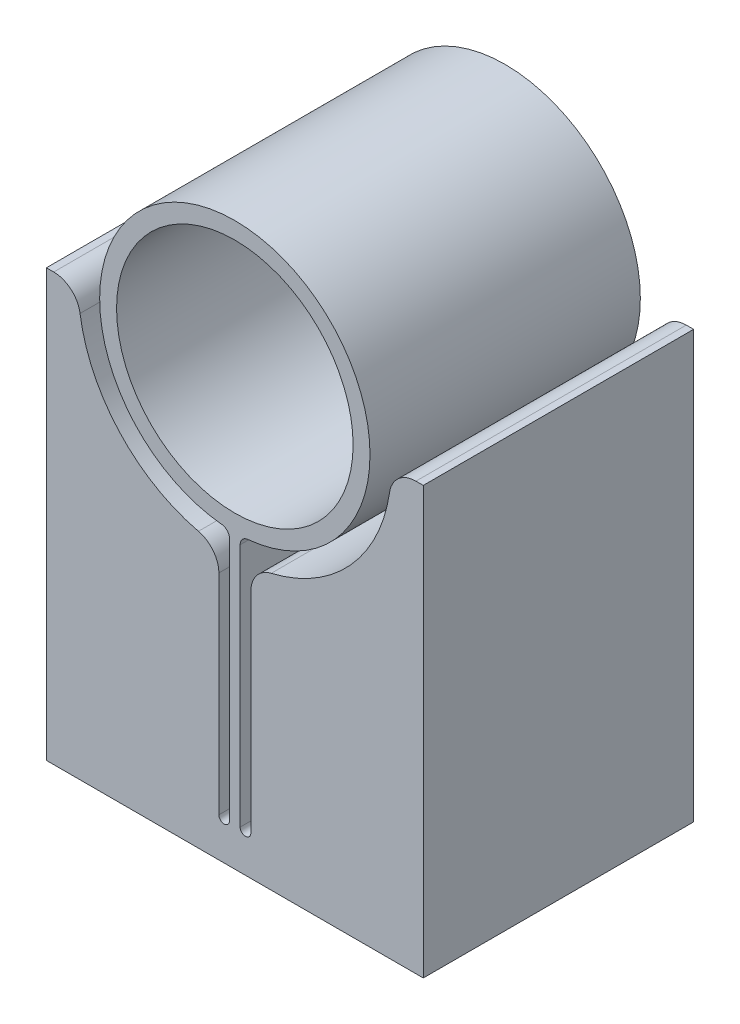
from build123d import *

# Parameters (mm, degrees)
SKETCH1_R                  = 11.1125
EXTRUDE1_DEPTH             = 12.7
BUSHING_SIDE_FILLETS_R     = 0.79375
MOUNT_SIDE_FILLETS_R       = 0.79375
F_1_4_MOUNTING_HOLES_D     = 5.1054
F_1_4_MOUNTING_HOLES_DEPTH = 19.05
F_1_4_MOUNTING_HOLES_TIP   = 1.533816902
CUT_EXTRUDE1_DEPTH         = 51.649420448
FILLET1_R                  = 2.5


with BuildPart() as part:
    # Sketch1 → Extrude1 (new, symmetric)
    with BuildSketch(Plane(origin=(0, 0, 0), x_dir=(1, 0, 0), z_dir=(0, 0, -1))):
        with BuildLine():
            Line((0.5, 12.690153663), (0.5, 30.5587))
            Line((0.5, 30.5587), (1.5, 30.5587))
            Line((1.5, 30.5587), (1.5, 14.623269128))
            ThreePointArc((1.5, 14.623269128), (10.911920088, 9.849873096), (14.7, 0))
            Line((14.7, 0), (17.705953405, 0))
            Line((17.705953405, 0), (17.705953405, 40.0837))
            Line((17.705953405, 40.0837), (-17.705953405, 40.0837))
            Line((-17.705953405, 40.0837), (-17.705953405, 0))
            Line((-17.705953405, 0), (-14.7, 0))
            ThreePointArc((-14.7, 0), (-10.911920088, 9.849873096), (-1.5, 14.623269128))
            Line((-1.5, 14.623269128), (-1.5, 30.5587))
            Line((-1.5, 30.5587), (-0.5, 30.5587))
            Line((-0.5, 30.5587), (-0.5, 12.690153663))
            ThreePointArc((-0.5, 12.690153663), (0, -12.7), (0.5, 12.690153663))
        make_face()
        Circle(SKETCH1_R, mode=Mode.SUBTRACT)
    extrude(amount=EXTRUDE1_DEPTH, both=True)

    # Bushing-side fillets
    bushing_side_fillets_edges = [part.edges().sort_by_distance(p)[0] for p in [
        (-0.5, -12.690153663, 0),
        (0.5, -12.690153663, 0),
    ]]
    fillet(bushing_side_fillets_edges, radius=BUSHING_SIDE_FILLETS_R)

    # Mount-side fillets
    mount_side_fillets_edges = [part.edges().sort_by_distance(p)[0] for p in [
        (-0.5, -30.5587, 0),
        (0.5, -30.5587, 0),
    ]]
    fillet(mount_side_fillets_edges, radius=MOUNT_SIDE_FILLETS_R)

    # 1/4 Mounting holes
    with Locations(Plane.XZ.offset(40.0837)):
        with Locations((-12.7, 0), (12.7, 0)):
            Hole(F_1_4_MOUNTING_HOLES_D / 2, depth=F_1_4_MOUNTING_HOLES_DEPTH)
            with Locations((0, 0, -(F_1_4_MOUNTING_HOLES_DEPTH + F_1_4_MOUNTING_HOLES_TIP / 2))):  # 118° drill point
                Cone(0, F_1_4_MOUNTING_HOLES_D / 2, F_1_4_MOUNTING_HOLES_TIP, mode=Mode.SUBTRACT)

    # Sketch6 → Cut-Extrude1 (cut, through all)
    with BuildSketch(Plane(origin=(0, 0, -12.7), x_dir=(-1, 0, 0), z_dir=(0, 0, -1))):
        with BuildLine():
            Line((0.5, -29.6587), (0.5, -36.4087))
            ThreePointArc((0.5, -36.4087), (1, -36.9087), (1.5, -36.4087))
            Line((1.5, -36.4087), (1.5, -30.5587))
            Line((1.5, -30.5587), (1.4, -30.5587))
            ThreePointArc((1.4, -30.5587), (0.763603897, -30.295096103), (0.5, -29.6587))
        make_face()
        with BuildLine():
            Line((-1.5, -30.5587), (-1.4, -30.5587))
            ThreePointArc((-1.4, -30.5587), (-0.763603897, -30.295096103), (-0.5, -29.6587))
            Line((-0.5, -29.6587), (-0.5, -36.4087))
            ThreePointArc((-0.5, -36.4087), (-1, -36.9087), (-1.5, -36.4087))
            Line((-1.5, -36.4087), (-1.5, -30.5587))
        make_face()
    extrude(amount=-CUT_EXTRUDE1_DEPTH, mode=Mode.SUBTRACT)

    # Fillet1
    fillet1_edges = [part.edges().sort_by_distance(p)[0] for p in [
        (-14.7, 0, 0),
        (-1.5, -14.623269128, 0),
        (1.5, -14.623269128, 0),
        (14.7, 0, 0),
    ]]
    fillet(fillet1_edges, radius=FILLET1_R)


solid = part.part
